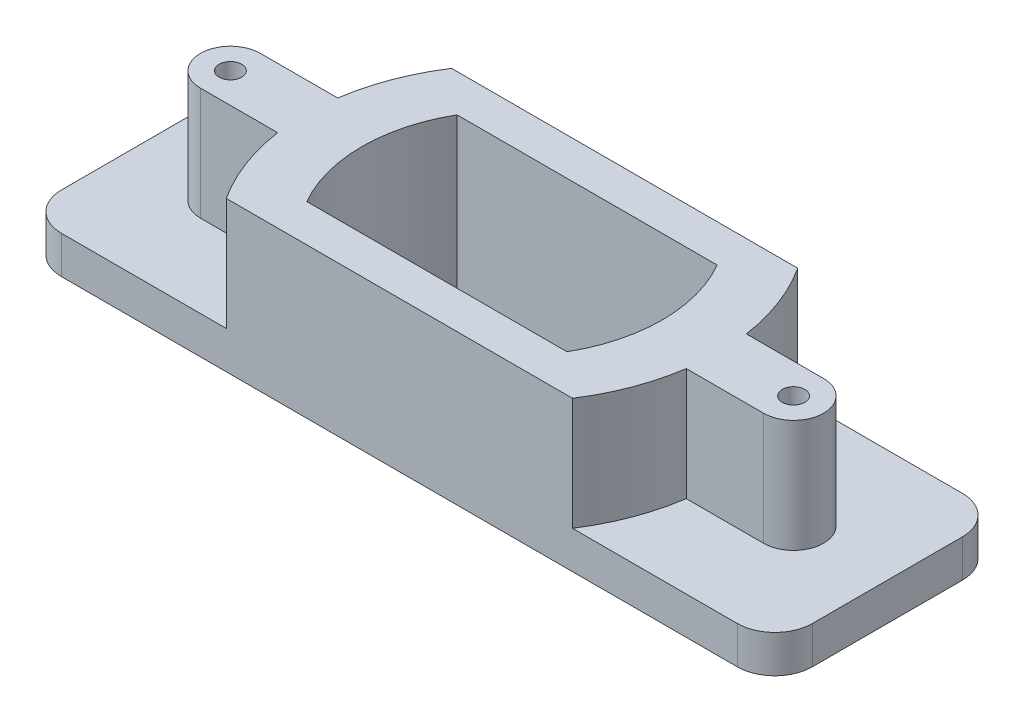
from build123d import *

# Parameters (mm, degrees)
EXTRUDE_2_DEPTH     = 10
EXTRUDE_3_DEPTH     = 30
SKETCH_7_R          = 3
CUT_EXTRUDE_3_DEPTH = 40


with BuildPart() as part:
    # 草图1 → 凸台-拉伸2 (new body)
    with BuildSketch(Plane(origin=(0, 0, 0), x_dir=(1, 0, 0), z_dir=(0, 1, 0))):
        with BuildLine():
            Line((100, -20), (100, 20))
            ThreePointArc((100, 20), (97.071067812, 27.071067812), (90, 30))
            Line((90, 30), (-90, 30))
            ThreePointArc((-90, 30), (-97.071067812, 27.071067812), (-100, 20))
            Line((-100, 20), (-100, -20))
            ThreePointArc((-100, -20), (-97.071067812, -27.071067812), (-90, -30))
            Line((-90, -30), (90, -30))
            ThreePointArc((90, -30), (97.071067812, -27.071067812), (100, -20))
        make_face()
    extrude(amount=EXTRUDE_2_DEPTH)

    # 草图5 → 凸台-拉伸3 (add)
    with BuildSketch(Plane(origin=(0, 10, 0), x_dir=(1, 0, 0), z_dir=(0, 1, 0))):
        with BuildLine():
            Line((-46.097722286, 30), (46.097722286, 30))
            ThreePointArc((46.097722286, 30), (51.446141019, 19.449796252), (54.415071442, 8))
            Line((54.415071442, 8), (75, 8))
            ThreePointArc((75, 8), (83, 0), (75, -8))
            Line((75, -8), (54.415071442, -8))
            ThreePointArc((54.415071442, -8), (51.446141019, -19.449796252), (46.097722286, -30))
            Line((46.097722286, -30), (-46.097722286, -30))
            ThreePointArc((-46.097722286, -30), (-51.446141019, -19.449796252), (-54.415071442, -8))
            Line((-54.415071442, -8), (-75, -8))
            ThreePointArc((-75, -8), (-83, 0), (-75, 8))
            Line((-75, 8), (-54.415071442, 8))
            ThreePointArc((-54.415071442, 8), (-51.446141019, 19.449796252), (-46.097722286, 30))
        make_face()
    extrude(amount=EXTRUDE_3_DEPTH)

    # 草图7 → 切除-拉伸3 (cut)
    with BuildSketch(Plane.XZ):
        with Locations(Location((-75, 0, 0), (0, 0, 270))):
            Circle(SKETCH_7_R)
        with Locations(Location((75, 0, 0), (0, 0, 90))):
            Circle(SKETCH_7_R)
        with BuildLine():
            Line((34.641016151, -20), (-34.641016151, -20))
            ThreePointArc((-34.641016151, -20), (-40, 0), (-34.641016151, 20))
            Line((-34.641016151, 20), (34.641016151, 20))
            ThreePointArc((34.641016151, 20), (40, 0), (34.641016151, -20))
        make_face()
    extrude(amount=-CUT_EXTRUDE_3_DEPTH, mode=Mode.SUBTRACT)


solid = part.part
